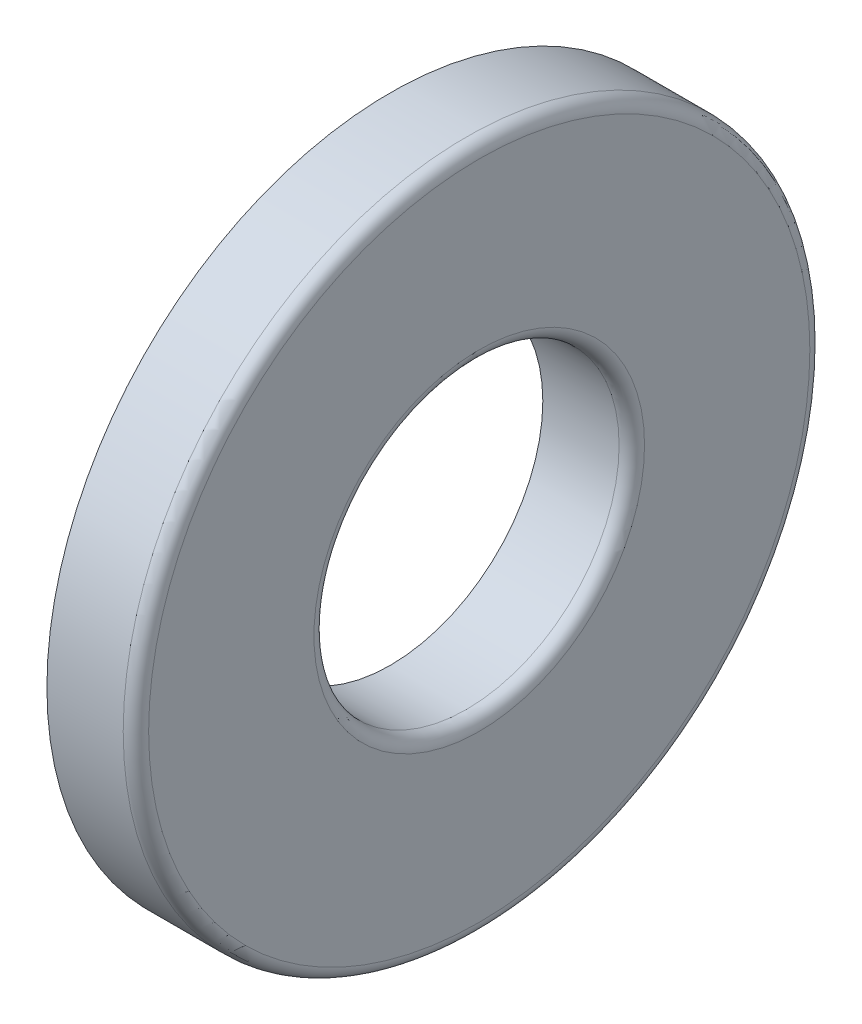
from build123d import *

# Parameters (mm, degrees)
CONG_1_R                = 0.5
ESQUISSE2_R             = 6
ENL_V_MAT_EXTRU_1_DEPTH = 20.410049083
CONG_2_R                = 0.5


with BuildPart() as part:
    # Esquisse1 → Base-Révolution (revolve)
    with BuildSketch(Plane.XY, mode=Mode.PRIVATE) as base_r_volution_sk:
        with BuildLine():
            Line((0, 0), (0, 7.341687605))
            ThreePointArc((0, 7.341687605), (0.5, 9), (0, 10.658312395))
            Line((0, 10.658312395), (0, 13.5))
            Line((0, 13.5), (3.5, 13.5))
            Line((3.5, 13.5), (3.5, 0))
            Line((3.5, 0), (0, 0))
        make_face()
    revolve(base_r_volution_sk.sketch.rotate(Axis((-2.5, 0, 0), (1, 0, 0)), 270), axis=Axis((-2.5, 0, 0), (1, 0, 0)))

    # Congé1
    cong_1_edges = [part.edges().sort_by_distance(p)[0] for p in [
        (3.5, 0, 13.5),
    ]]
    fillet(cong_1_edges, radius=CONG_1_R)

    # Esquisse2 → Enlèv. mat.-Extru.1 (cut, through all)
    with BuildSketch(Plane(origin=(3.5, 0, 0), x_dir=(0, 0, -1), z_dir=(1, 0, 0))):
        Circle(ESQUISSE2_R)
    extrude(amount=-ENL_V_MAT_EXTRU_1_DEPTH, mode=Mode.SUBTRACT)

    # Congé2
    cong_2_edges = [part.edges().sort_by_distance(p)[0] for p in [
        (3.5, 0, 6),
    ]]
    fillet(cong_2_edges, radius=CONG_2_R)


solid = part.part
